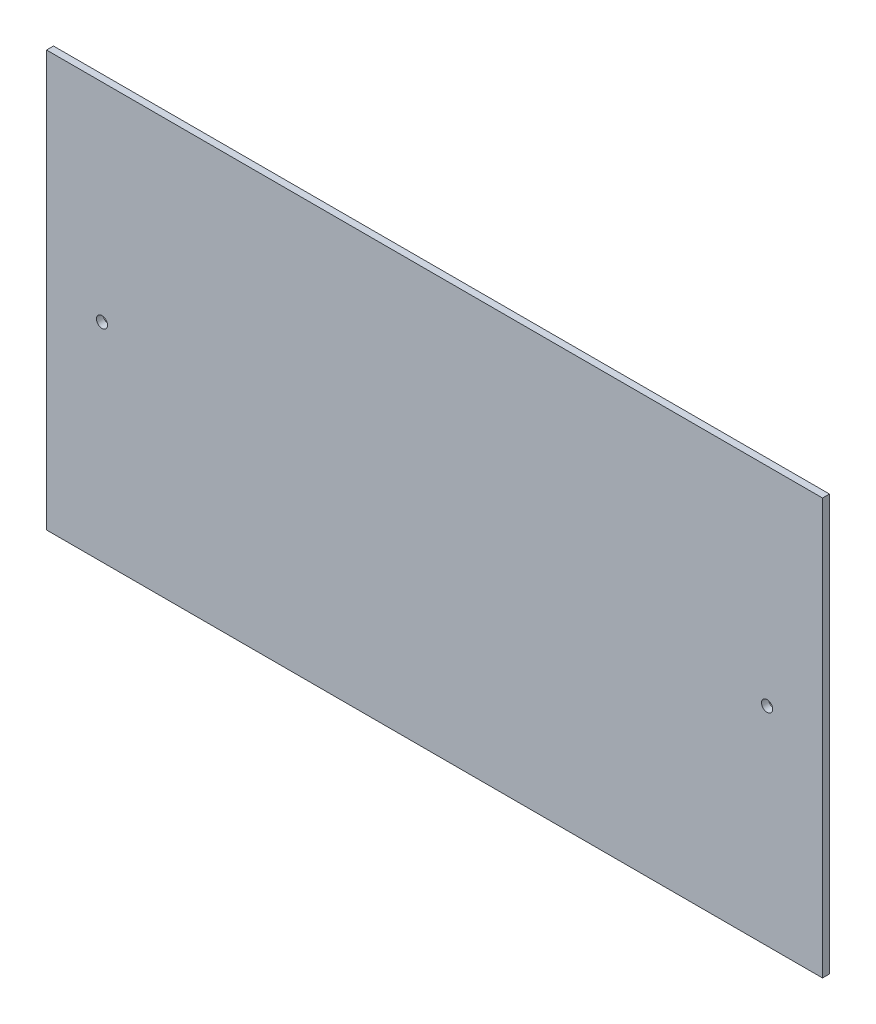
from build123d import *

# Parameters (mm, degrees)
SCHIZZO1_W                   = 280
SCHIZZO1_H                   = 150
ESTRUSIONE_ESTRUSIONE1_DEPTH = 2.5
SCHIZZO2_R                   = 2
TAGLIO_ESTRUSIONE1_DEPTH     = 10


with BuildPart() as part:
    # Schizzo1 → Estrusione-Estrusione1 (new body)
    with BuildSketch(Plane.XY):
        with Locations((140, 75)):
            Rectangle(SCHIZZO1_W, SCHIZZO1_H)
    extrude(amount=ESTRUSIONE_ESTRUSIONE1_DEPTH)

    # Schizzo2 → Taglio-Estrusione1 (cut)
    with BuildSketch(Plane.XY.offset(2.5)):
        with Locations((260, 75)):
            Circle(SCHIZZO2_R)
        with Locations((20, 75)):
            Circle(SCHIZZO2_R)
    extrude(amount=-TAGLIO_ESTRUSIONE1_DEPTH, mode=Mode.SUBTRACT)


solid = part.part
